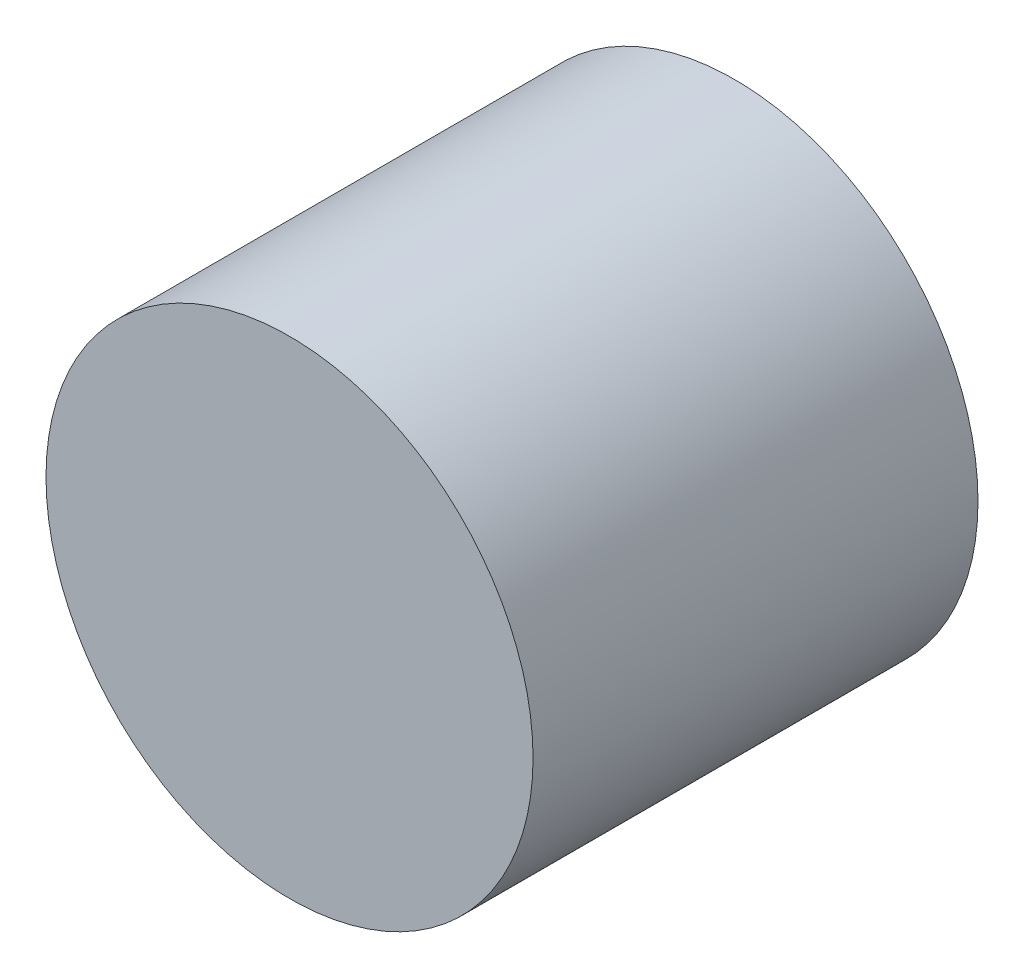
from build123d import *

# Parameters (mm, degrees)
SKETCH1_R      = 27.804150842
EXTRUDE1_DEPTH = 50.8


with BuildPart() as part:
    # Sketch1 → Extrude1 (new body)
    with BuildSketch(Plane.XY):
        Circle(SKETCH1_R)
    extrude(amount=EXTRUDE1_DEPTH)


solid = part.part
